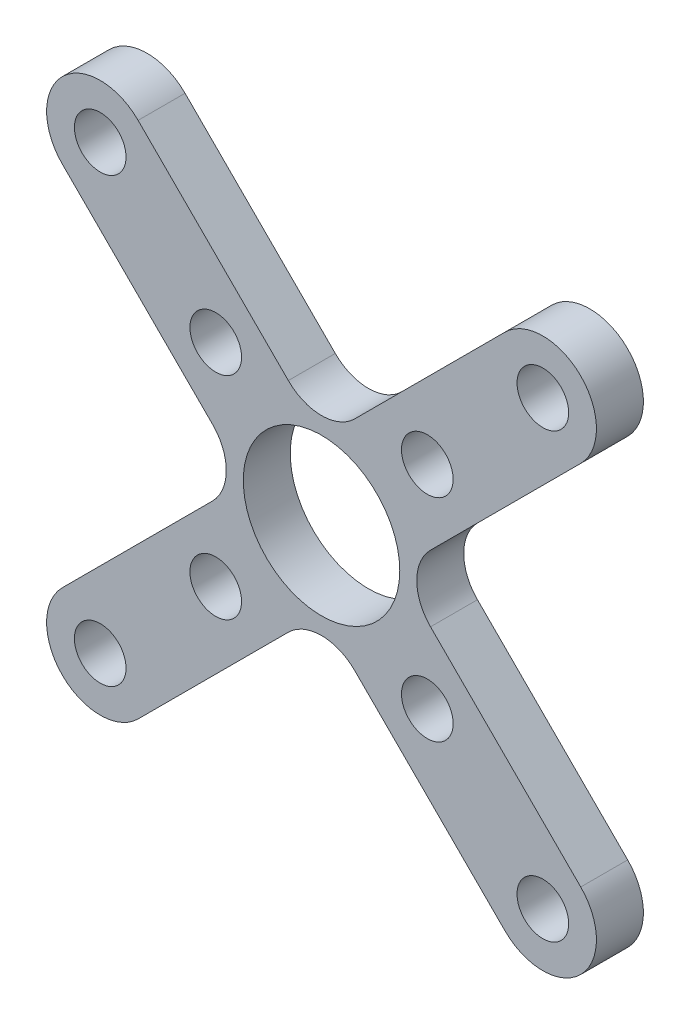
from build123d import *

# Parameters (mm, degrees)
SKETCH1_R           = 1.65
SKETCH1_R_2         = 5
BOSS_EXTRUDE1_DEPTH = 3


with BuildPart() as part:
    # Sketch1 → Boss-Extrude1 (new body)
    with BuildSketch(Plane.XY):
        with BuildLine():
            Line((16.563434593, 11.720833187), (6.963921749, 2.121320344))
            ThreePointArc((6.963921749, 2.121320344), (6.085242093, 0), (6.963921749, -2.121320344))
            Line((6.963921749, -2.121320344), (16.563434593, -11.720833187))
            ThreePointArc((16.563434593, -11.720833187), (16.563434593, -16.563434593), (11.720833187, -16.563434593))
            Line((11.720833187, -16.563434593), (2.121320344, -6.963921749))
            ThreePointArc((2.121320344, -6.963921749), (0, -6.085242093), (-2.121320344, -6.963921749))
            Line((-2.121320344, -6.963921749), (-11.720833187, -16.563434593))
            ThreePointArc((-11.720833187, -16.563434593), (-16.56343546, -16.563437193), (-16.563436326, -11.720834921))
            Line((-16.563436326, -11.720834921), (-6.963921749, -2.121320344))
            ThreePointArc((-6.963921749, -2.121320344), (-6.085242093, 0), (-6.963921749, 2.121320344))
            Line((-6.963921749, 2.121320344), (-16.563434593, 11.720833187))
            ThreePointArc((-16.563434593, 11.720833187), (-16.563434593, 16.563434593), (-11.720833187, 16.563434593))
            Line((-11.720833187, 16.563434593), (-2.121320344, 6.963921749))
            ThreePointArc((-2.121320344, 6.963921749), (0, 6.085242093), (2.121320344, 6.963921749))
            Line((2.121320344, 6.963921749), (11.720833187, 16.563434593))
            ThreePointArc((11.720833187, 16.563434593), (16.563436326, 16.563436326), (16.563434593, 11.720833187))
        make_face()
        with Locations((-14.14213389, 14.14213389)):
            Circle(SKETCH1_R, mode=Mode.SUBTRACT)
        with Locations((14.142135624, 14.142135624)):
            Circle(SKETCH1_R, mode=Mode.SUBTRACT)
        with Locations((-14.142135624, -14.142135624)):
            Circle(SKETCH1_R, mode=Mode.SUBTRACT)
        with Locations((14.14213389, -14.14213389)):
            Circle(SKETCH1_R, mode=Mode.SUBTRACT)
        Circle(SKETCH1_R_2, mode=Mode.SUBTRACT)
        with Locations((-6.759874347, 6.759874347)):
            Circle(SKETCH1_R, mode=Mode.SUBTRACT)
        with Locations(Location((6.759874347, 6.759874347, 0), (0, 0, 180))):
            Circle(SKETCH1_R, mode=Mode.SUBTRACT)
        with Locations((6.759874347, -6.759874347)):
            Circle(SKETCH1_R, mode=Mode.SUBTRACT)
        with Locations(Location((-6.759874347, -6.759874347, 0), (0, 0, 180))):
            Circle(SKETCH1_R, mode=Mode.SUBTRACT)
    extrude(amount=BOSS_EXTRUDE1_DEPTH)


solid = part.part
